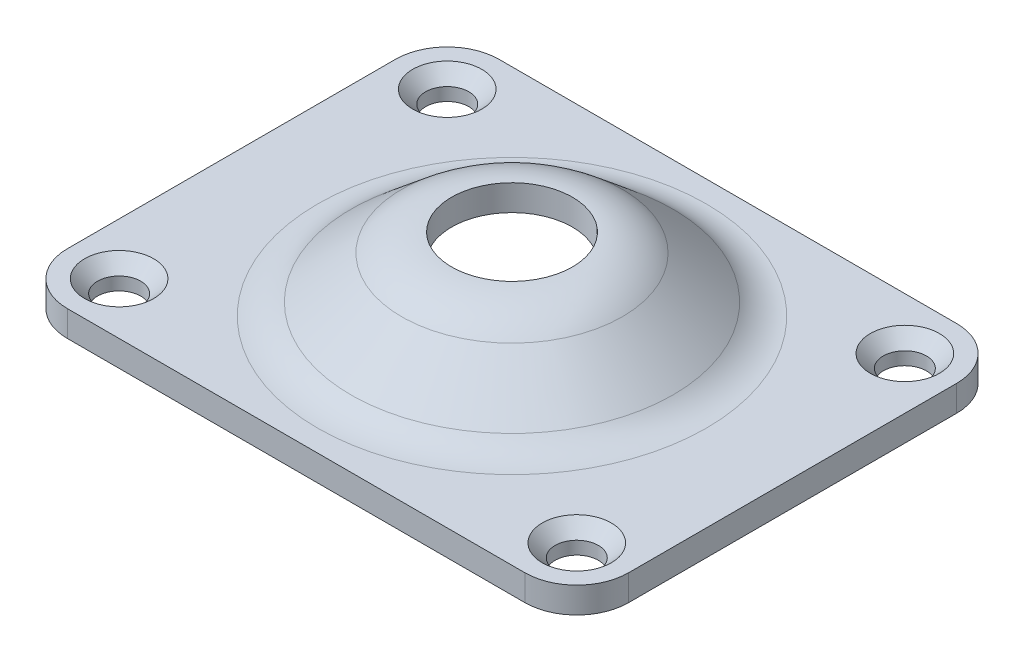
from build123d import *

# Parameters (mm, degrees)
SKETCH1_R           = 2.5
SKETCH1_R_2         = 22.5
BOSS_EXTRUDE1_DEPTH = 3
CHAMFER1_SIZE       = 1.5


with BuildPart() as part:
    # Sketch1 → Boss-Extrude1 (new body)
    with BuildSketch(Plane(origin=(0, 0, 0), x_dir=(1, 0, 0), z_dir=(0, 1, 0))):
        with BuildLine():
            Line((-26.5, -25), (26.5, -25))
            ThreePointArc((26.5, -25), (30.742640687, -23.242640687), (32.5, -19))
            Line((32.5, -19), (32.5, 19))
            ThreePointArc((32.5, 19), (30.742640687, 23.242640687), (26.5, 25))
            Line((26.5, 25), (-26.5, 25))
            ThreePointArc((-26.5, 25), (-30.742640687, 23.242640687), (-32.5, 19))
            Line((-32.5, 19), (-32.5, -19))
            ThreePointArc((-32.5, -19), (-30.742640687, -23.242640687), (-26.5, -25))
        make_face()
        with Locations(Location((-26.5, 19, 0), (0, 0, 270))):
            Circle(SKETCH1_R, mode=Mode.SUBTRACT)
        with Locations(Location((26.5, 19, 0), (0, 0, 270))):
            Circle(SKETCH1_R, mode=Mode.SUBTRACT)
        with Locations(Location((26.5, -19, 0), (0, 0, 270))):
            Circle(SKETCH1_R, mode=Mode.SUBTRACT)
        with Locations(Location((-26.5, -19, 0), (0, 0, 270))):
            Circle(SKETCH1_R, mode=Mode.SUBTRACT)
        with Locations(Location((0, 0, 0), (0, 0, 270))):
            Circle(SKETCH1_R_2, mode=Mode.SUBTRACT)
    extrude(amount=BOSS_EXTRUDE1_DEPTH)

    # Sketch2 → Revolve1 (revolve)
    with BuildSketch(Plane.XY, mode=Mode.PRIVATE) as revolve1_sk:
        with BuildLine():
            Line((-18.643274342, 4.403733341), (-12.785088487, 9.319334931))
            ThreePointArc((-12.785088487, 9.319334931), (-10.07818129, 10.88216853), (-7, 11.424934943))
            Line((-7, 11.424934943), (-7, 8.424934943))
            ThreePointArc((-7, 8.424934943), (-9.05212086, 8.063090668), (-10.856725658, 7.021201602))
            Line((-10.856725658, 7.021201602), (-16.714911513, 2.105600012))
            ThreePointArc((-16.714911513, 2.105600012), (-19.42181871, 0.542766413), (-22.5, 0))
            Line((-22.5, 0), (-22.5, 3))
            ThreePointArc((-22.5, 3), (-20.44787914, 3.361844275), (-18.643274342, 4.403733341))
        make_face()
    revolve(revolve1_sk.sketch.rotate(Axis((0, 3, 0), (0, 1, 0)), 180), axis=Axis((0, 3, 0), (0, 1, 0)))

    # Chamfer1
    chamfer1_edges = [part.edges().sort_by_distance(p)[0] for p in [
        (-26.5, 3, -21.5),
        (26.5, 3, -21.5),
        (26.5, 3, 16.5),
        (-26.5, 3, 16.5),
    ]]
    chamfer(chamfer1_edges, length=CHAMFER1_SIZE)


solid = part.part
